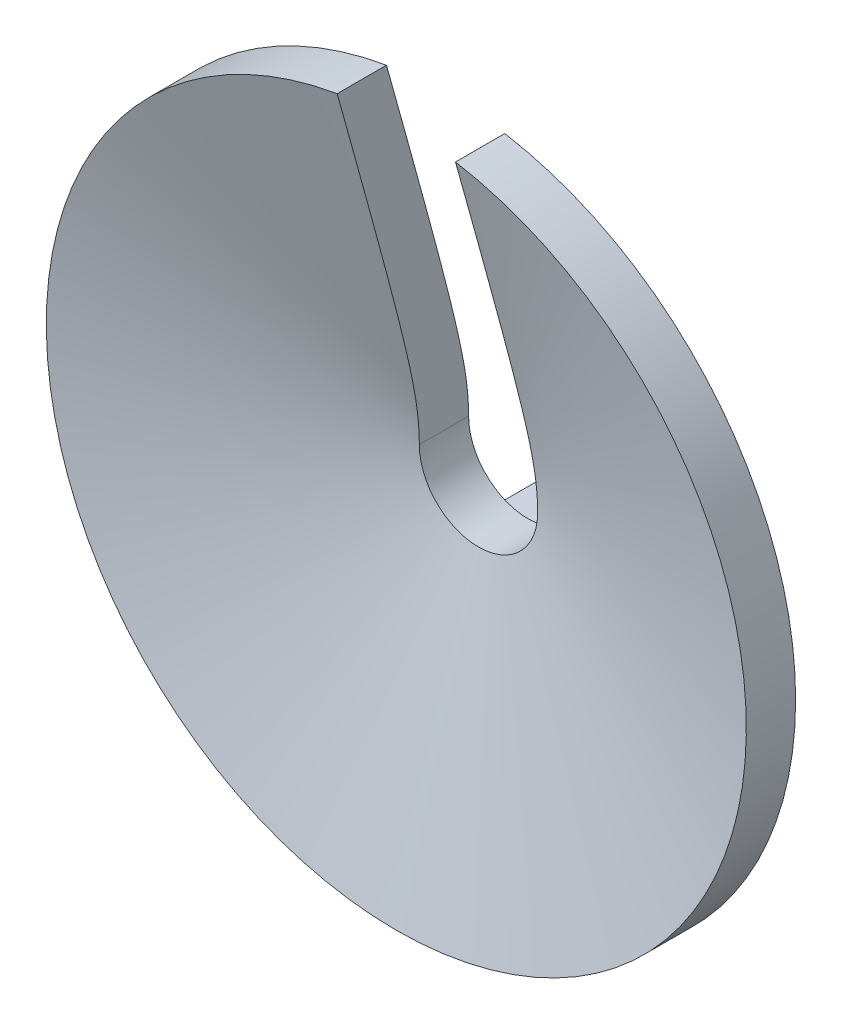
from build123d import *

# Parameters (mm, degrees)
SKETCH1_R           = 35.5
BOSS_EXTRUDE1_DEPTH = 15
CUT_EXTRUDE2_REACH  = 54.398
BOSS_EXTRUDE2_REACH = 64.398
BOSS_EXTRUDE2_START = -10
CUT_EXTRUDE3_START  = -36
SKETCH5_W           = 10.5
SKETCH5_H           = 5.5
CUT_EXTRUDE3_DEPTH  = 22
CHAMFER1_SIZE       = 0.6
CHAMFER2_SIZE       = 2
CUT_EXTRUDE4_REACH  = 58.085
SKETCH6_R           = 3


with BuildPart() as part:
    # Sketch1 → Boss-Extrude1 (new body)
    with BuildSketch(Plane.XY):
        Circle(SKETCH1_R)
    extrude(amount=BOSS_EXTRUDE1_DEPTH)

    # Sketch2 → Cut-Revolve3 (revolve, cut)
    with BuildSketch(Plane(origin=(0, 0, 0), x_dir=(1, 0, 0), z_dir=(0, 1, 0)), mode=Mode.PRIVATE) as cut_revolve3_sk:
        Polygon((-35.5, 0), (-0.1, 0), (-35.5, -10), align=None)
        Polygon((-0.1, -15), (-0.1, -5), (-35.5, -15), align=None)
    revolve(cut_revolve3_sk.sketch.rotate(Axis((0, 0, 0), (0, 0, 1)), 180), axis=Axis((0, 0, 0), (0, 0, 1)), mode=Mode.SUBTRACT)

    # Sketch3 → Cut-Extrude2 (cut, up to next)
    with BuildSketch(Plane.XY, mode=Mode.PRIVATE) as cut_extrude2_sk1:
        with BuildLine():
            Line((6, 35.5), (6, 0))
            ThreePointArc((6, 0), (0, -6), (-6, 0))
            Line((-6, 0), (-6, 35.5))
            ThreePointArc((-6, 35.5), (0, 41.5), (6, 35.5))
        make_face()
    cut_extrude2_tool1 = extrude(cut_extrude2_sk1.sketch, amount=CUT_EXTRUDE2_REACH, mode=Mode.PRIVATE) & part.part
    add(cut_extrude2_tool1.solids().sort_by_distance((0, 17.75, 0))[0], mode=Mode.SUBTRACT)

    # Boss-Extrude2: up to this cone (the profile starts outside it)
    boss_extrude2_end = Plane(origin=(0, 0, -10), z_dir=(0, 0, 1)).offset(9.971752412) * Cone(3.54e-06, 194.43892, 54.926247588, align=(Align.CENTER, Align.CENTER, Align.MIN), mode=Mode.PRIVATE)
    # Sketch4 → Boss-Extrude2 (add, up to the surface)
    with BuildSketch(Plane.XY.offset(BOSS_EXTRUDE2_START), mode=Mode.PRIVATE) as boss_extrude2_sk1:
        with BuildLine():
            Line((-8.175, -9.370902434), (8.175, -9.370902434))
            Line((8.175, -9.370902434), (8.175, -34.545902434))
            ThreePointArc((8.175, -34.545902434), (0, -35.5), (-8.175, -34.545902434))
            Line((-8.175, -34.545902434), (-8.175, -9.370902434))
        make_face()
    boss_extrude2_tool1 = extrude(boss_extrude2_sk1.sketch, amount=BOSS_EXTRUDE2_REACH, mode=Mode.PRIVATE) - boss_extrude2_end
    add(boss_extrude2_tool1.solids().sort_by_distance((0, -22.278861, -10))[0])

    # Sketch5 → Cut-Extrude3 (cut)
    with BuildSketch(Plane(origin=(0, 0, 0), x_dir=(1, 0, 0), z_dir=(0, 1, 0)).offset(CUT_EXTRUDE3_START)):
        with Locations((0, 2.75)):
            Rectangle(SKETCH5_W, SKETCH5_H)
    extrude(amount=CUT_EXTRUDE3_DEPTH, mode=Mode.SUBTRACT)

    # Chamfer1
    chamfer1_edges = [part.edges().sort_by_distance(p)[0] for p in [
        (-5.25, -24.554824835, -5.5),
        (-5.25, -24.554824835, 0),
        (5.25, -24.554824835, 0),
        (5.25, -24.554824835, -5.5),
    ]]
    chamfer(chamfer1_edges, length=CHAMFER1_SIZE)

    # Chamfer2
    chamfer2_edges = [part.edges().sort_by_distance(p)[0] for p in [
        (8.175, -9.370902434, -3.257681969),
        (-8.175, -9.370902434, -3.257681969),
        (8.175, -21.958402434, -10),
        (0, -9.370902434, -10),
        (-8.175, -21.958402434, -10),
    ]]
    chamfer(chamfer2_edges, length=CHAMFER2_SIZE)

    # Sketch6 → Cut-Extrude4 (cut, up to next)
    with BuildSketch(Plane(origin=(0, 0, -10), x_dir=(-1, 0, 0), z_dir=(0, 0, -1)), mode=Mode.PRIVATE) as cut_extrude4_sk1:
        with Locations((0, -21)):
            Circle(SKETCH6_R)
    cut_extrude4_tool1 = extrude(cut_extrude4_sk1.sketch, amount=-CUT_EXTRUDE4_REACH, mode=Mode.PRIVATE) & part.part
    add(cut_extrude4_tool1.solids().sort_by_distance((0, -21, -10))[0], mode=Mode.SUBTRACT)


solid = part.part
